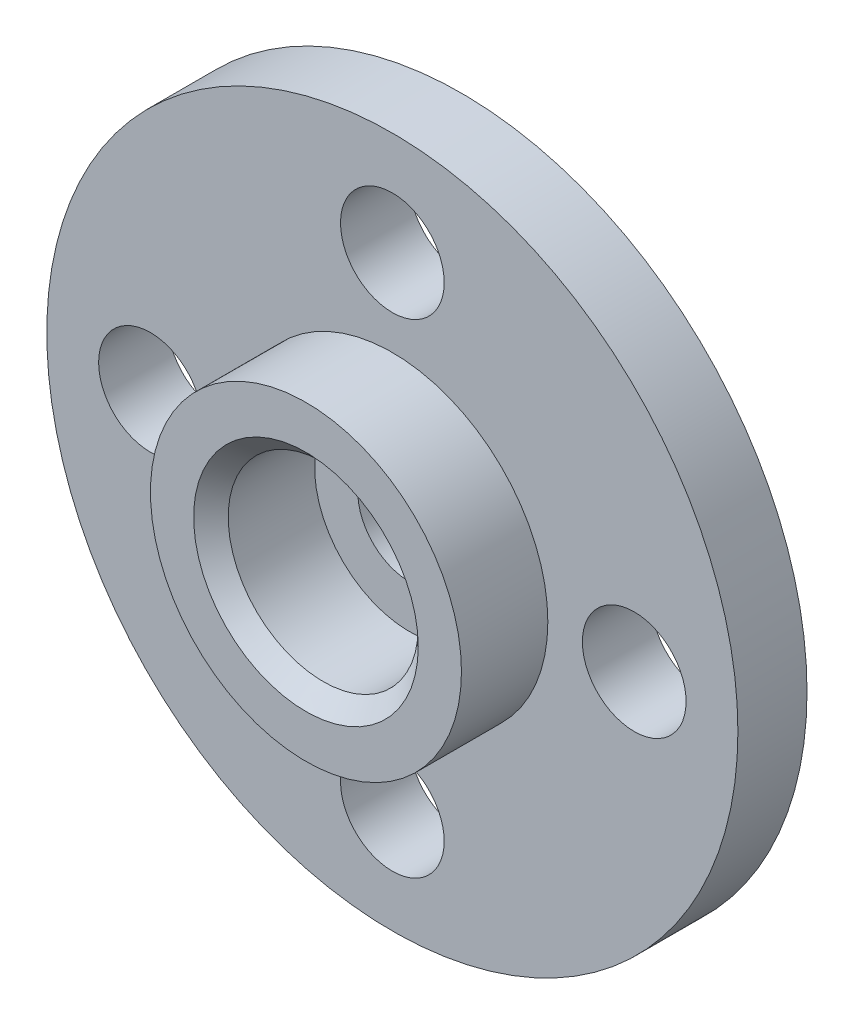
from build123d import *

# Parameters (mm, degrees)
SKETCH_1_R          = 10
EXTRUDE_1_DEPTH     = 2
SKETCH_3_R          = 4.5
EXTRUDE_2_DEPTH     = 2.5
SKETCH_4_R          = 1.5
CUT_EXTRUDE_1_DEPTH = 15.84082208
SKETCH_5_R          = 2.75
CUT_EXTRUDE_2_DEPTH = 3
CHAMFER_1_SIZE      = 0.5
SKETCH_6_R          = 1.5
CUT_EXTRUDE_3_DEPTH = 15.84082208


with BuildPart() as part:
    # 草图1 → 凸台-拉伸1 (new body)
    with BuildSketch(Plane.XY):
        Circle(SKETCH_1_R)
    extrude(amount=EXTRUDE_1_DEPTH)

    # 草图3 → 凸台-拉伸2 (add)
    with BuildSketch(Plane.XY.offset(2)):
        Circle(SKETCH_3_R)
    extrude(amount=EXTRUDE_2_DEPTH)

    # 草图4 → 切除-拉伸1 (cut, through all)
    with BuildSketch(Plane.XY.offset(4.5)):
        Circle(SKETCH_4_R)
    extrude(amount=-CUT_EXTRUDE_1_DEPTH, mode=Mode.SUBTRACT)

    # 草图5 → 切除-拉伸2 (cut)
    with BuildSketch(Plane.XY.offset(4.5)):
        Circle(SKETCH_5_R)
    extrude(amount=-CUT_EXTRUDE_2_DEPTH, mode=Mode.SUBTRACT)

    # 倒角1
    chamfer_1_edges = [part.edges().sort_by_distance(p)[0] for p in [
        (-2.75, 0, 4.5),
    ]]
    chamfer(chamfer_1_edges, length=CHAMFER_1_SIZE)

    # 草图6 → 切除-拉伸3 (cut, through all)
    with BuildSketch(Plane(origin=(0, 0, 0), x_dir=(-1, 0, 0), z_dir=(0, 0, -1))):
        with Locations((-7, 0)):
            Circle(SKETCH_6_R)
        with Locations((0, 7)):
            Circle(SKETCH_6_R)
        with Locations((7, 0)):
            Circle(SKETCH_6_R)
        with Locations((0, -7)):
            Circle(SKETCH_6_R)
    extrude(amount=-CUT_EXTRUDE_3_DEPTH, mode=Mode.SUBTRACT)


solid = part.part
